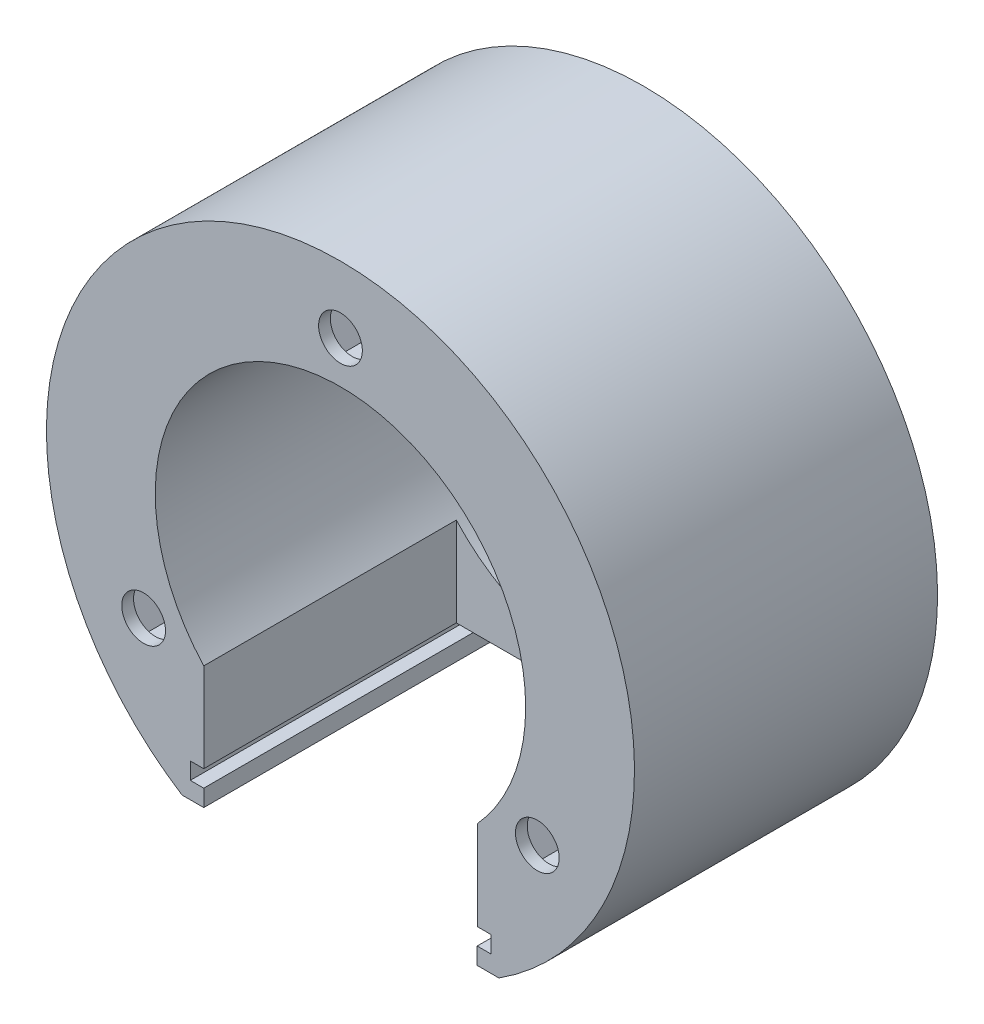
from build123d import *

# Parameters (mm, degrees)
SKETCH2_R           = 17.4625
BOSS_EXTRUDE1_DEPTH = 18
SKETCH13_R          = 1.3
CUT_EXTRUDE6_DEPTH  = 15
SKETCH16_R          = 11
CUT_EXTRUDE9_DEPTH  = 15
CUT_EXTRUDE11_DEPTH = 22
SKETCH21_W          = 16.25
SKETCH21_H          = 2.78436417
CUT_EXTRUDE12_DEPTH = 31.559414466
CUT_EXTRUDE13_REACH = 32.559
SKETCH24_W          = 16.25
SKETCH24_H          = 6.70136321
CUT_EXTRUDE14_DEPTH = 17
SKETCH27_W          = 18.82071266
SKETCH27_H          = 0.75
CUT_EXTRUDE15_DEPTH = 31.559414466
CUT_EXTRUDE16_START = 14.3
CUT_EXTRUDE16_DEPTH = 1.8
SKETCH29_R          = 11
CUT_EXTRUDE17_DEPTH = 1.75


with BuildPart() as part:
    # Sketch2 → Boss-Extrude1 (new body)
    with BuildSketch(Plane.XY):
        Circle(SKETCH2_R)
    extrude(amount=BOSS_EXTRUDE1_DEPTH)

    # Sketch13 → Cut-Extrude6 (cut)
    with BuildSketch(Plane.XY.offset(18)):
        with Locations((0, 13.5)):
            Circle(SKETCH13_R)
        with Locations((11.691342951, -6.75)):
            Circle(SKETCH13_R)
        with Locations((-11.691342951, -6.75)):
            Circle(SKETCH13_R)
    extrude(amount=-CUT_EXTRUDE6_DEPTH, mode=Mode.SUBTRACT)

    # Sketch16 → Cut-Extrude9 (cut)
    with BuildSketch(Plane.XY.offset(18)):
        Circle(SKETCH16_R)
    extrude(amount=-CUT_EXTRUDE9_DEPTH, mode=Mode.SUBTRACT)

    # Sketch20 → Cut-Extrude11 (cut)
    with BuildSketch(Plane(origin=(5.95728493, 0, -11.08430825), x_dir=(0, 0, 1), z_dir=(0, 1, 0))):
        Polygon((16.52930825, -11.021800725), (16.52930825, -6.906800725), (14.92930825, -6.906800725), (14.92930825, -4.926800725), (16.52930825, -4.926800725), (16.52930825, -0.811800725), (18.05430825, -0.811800725), (18.05430825, 1.028199275), (22.11430825, 1.028199275), (22.11430825, -0.811800725), (23.63930825, -0.811800725), (23.63930825, -11.021800725), (22.11430825, -11.021800725), (22.11430825, -12.861800725), (18.05430825, -12.861800725), (18.05430825, -11.021800725), align=None)
    extrude(amount=-CUT_EXTRUDE11_DEPTH, mode=Mode.SUBTRACT)

    # Sketch21 → Cut-Extrude12 (cut, through all)
    with BuildSketch(Plane.XY.offset(18)):
        with Locations((0, -16.852182085)):
            Rectangle(SKETCH21_W, SKETCH21_H)
    extrude(amount=-CUT_EXTRUDE12_DEPTH, mode=Mode.SUBTRACT)

    # Cut-Extrude13: up to this face of the body (flat: up to its plane)
    cut_extrude13_end = Plane(part.part.faces().sort_by_distance((0, 0, 3))[0])
    # Sketch24 → Cut-Extrude13 (cut, up to the picked face)
    with BuildSketch(Plane.XY.offset(18), mode=Mode.PRIVATE) as cut_extrude13_sk1:
        with Locations((0.005436819, -10.109318395)):
            Rectangle(SKETCH24_W, SKETCH24_H)
    cut_extrude13_tool1 = split(extrude(cut_extrude13_sk1.sketch, amount=-CUT_EXTRUDE13_REACH, mode=Mode.PRIVATE), bisect_by=cut_extrude13_end, keep=Keep.BOTH, mode=Mode.PRIVATE)
    add(cut_extrude13_tool1.solids().sort_by(Axis((0.005437, -10.109318, 18), (0, 0, -1)))[0], mode=Mode.SUBTRACT)

    # Sketch26 → Cut-Extrude14 (cut)
    with BuildSketch(Plane.XY.offset(18)):
        Polygon((-8.119563181, -13.71), (-8.119563181, -15.46), (8.119563181, -15.46), (8.119563181, -13.71), (8.930436819, -13.71), (8.930436819, -12.71), (-8.919563181, -12.71), (-8.919563181, -13.71), align=None)
    extrude(amount=-CUT_EXTRUDE14_DEPTH, mode=Mode.SUBTRACT)

    # Sketch27 → Cut-Extrude15 (cut, through all)
    with BuildSketch(Plane.XY.offset(18)):
        with Locations((0, -15.085)):
            Rectangle(SKETCH27_W, SKETCH27_H)
    extrude(amount=-CUT_EXTRUDE15_DEPTH, mode=Mode.SUBTRACT)

    # Sketch28 → Cut-Extrude16 (cut)
    with BuildSketch(Plane.XY.offset(3).offset(CUT_EXTRUDE16_START)):
        Polygon((2.309401077, 13.5), (1.154700538, 15.5), (-1.154700538, 15.5), (-2.309401077, 13.5), (-1.154700538, 11.5), (1.154700538, 11.5), align=None)
        Polygon((-9.381941874, -6.75), (-10.536642413, -4.75), (-12.846043489, -4.75), (-14.000744028, -6.75), (-12.846043489, -8.75), (-10.536642413, -8.75), align=None)
        Polygon((14.000744028, -6.75), (12.846043489, -4.75), (10.536642413, -4.75), (9.381941874, -6.75), (10.536642413, -8.75), (12.846043489, -8.75), align=None)
    extrude(amount=-CUT_EXTRUDE16_DEPTH, mode=Mode.SUBTRACT)

    # Sketch29 → Cut-Extrude17 (cut)
    with BuildSketch(Plane.XY.offset(3)):
        Circle(SKETCH29_R)
    extrude(amount=-CUT_EXTRUDE17_DEPTH, mode=Mode.SUBTRACT)


solid = part.part
